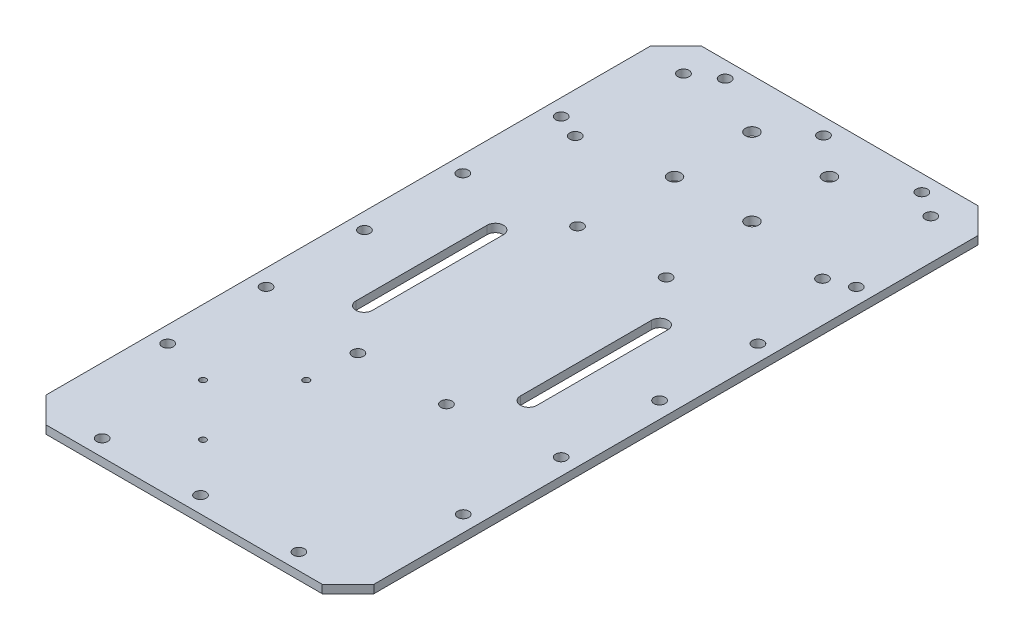
from build123d import *

# Parameters (mm, degrees)
SKETCH2_R           = 2.159
SKETCH2_R_2         = 2.54
SKETCH2_R_3         = 1.25
BOSS_EXTRUDE1_DEPTH = 3.175


with BuildPart() as part:
    # Sketch2 → Boss-Extrude1 (new body)
    with BuildSketch(Plane(origin=(0, 0, 0), x_dir=(1, 0, 0), z_dir=(0, 1, 0))):
        Polygon((0, 10), (0, 244), (10, 254), (117, 254), (127, 244), (127, 10), (117, 0), (10, 0), align=None)
        with Locations(Location((6.35, 88.9, 0), (0, 0, 270))):
            Circle(SKETCH2_R, mode=Mode.SUBTRACT)
        with Locations(Location((6.35, 165.1, 0), (0, 0, 270))):
            Circle(SKETCH2_R, mode=Mode.SUBTRACT)
        with Locations(Location((120.65, 165.1, 0), (0, 0, 270))):
            Circle(SKETCH2_R, mode=Mode.SUBTRACT)
        with Locations(Location((120.81, 50.8, 0), (0, 0, 270))):
            Circle(SKETCH2_R, mode=Mode.SUBTRACT)
        with Locations(Location((6.35, 50.8, 0), (0, 0, 270))):
            Circle(SKETCH2_R, mode=Mode.SUBTRACT)
        with Locations(Location((25.4, 247.65, 0), (0, 0, 270))):
            Circle(SKETCH2_R, mode=Mode.SUBTRACT)
        with Locations(Location((101.6, 247.65, 0), (0, 0, 270))):
            Circle(SKETCH2_R, mode=Mode.SUBTRACT)
        with Locations(Location((101.6, 6.35, 0), (0, 0, 270))):
            Circle(SKETCH2_R, mode=Mode.SUBTRACT)
        with Locations(Location((25.4, 6.35, 0), (0, 0, 270))):
            Circle(SKETCH2_R, mode=Mode.SUBTRACT)
        with Locations(Location((15.621, 241.3, 0), (0, 0, 270))):
            Circle(SKETCH2_R, mode=Mode.SUBTRACT)
        with Locations(Location((15.621, 199.39, 0), (0, 0, 270))):
            Circle(SKETCH2_R, mode=Mode.SUBTRACT)
        with Locations(Location((111.379, 199.39, 0), (0, 0, 270))):
            Circle(SKETCH2_R, mode=Mode.SUBTRACT)
        with Locations(Location((111.379, 241.3, 0), (0, 0, 270))):
            Circle(SKETCH2_R, mode=Mode.SUBTRACT)
        with Locations(Location((46.355, 169.545, 0), (0, 0, 270))):
            Circle(SKETCH2_R, mode=Mode.SUBTRACT)
        with Locations(Location((46.355, 84.455, 0), (0, 0, 270))):
            Circle(SKETCH2_R, mode=Mode.SUBTRACT)
        with Locations(Location((80.645, 84.455, 0), (0, 0, 270))):
            Circle(SKETCH2_R, mode=Mode.SUBTRACT)
        with Locations(Location((80.645, 169.545, 0), (0, 0, 270))):
            Circle(SKETCH2_R, mode=Mode.SUBTRACT)
        with Locations(Location((120.65, 88.9, 0), (0, 0, 270))):
            Circle(SKETCH2_R, mode=Mode.SUBTRACT)
        with Locations(Location((48.50003, 234.95, 0), (0, 0, 270))):
            Circle(SKETCH2_R_2, mode=Mode.SUBTRACT)
        with Locations(Location((78.49997, 234.95, 0), (0, 0, 270))):
            Circle(SKETCH2_R_2, mode=Mode.SUBTRACT)
        with Locations(Location((78.49997, 204.95006, 0), (0, 0, 270))):
            Circle(SKETCH2_R_2, mode=Mode.SUBTRACT)
        with Locations(Location((48.50003, 204.95006, 0), (0, 0, 270))):
            Circle(SKETCH2_R_2, mode=Mode.SUBTRACT)
        with Locations(Location((120.65, 203.2, 0), (0, 0, 270))):
            Circle(SKETCH2_R, mode=Mode.SUBTRACT)
        with Locations(Location((6.35, 203.2, 0), (0, 0, 270))):
            Circle(SKETCH2_R, mode=Mode.SUBTRACT)
        with Locations(Location((63.5, 247.65, 0), (0, 0, 270))):
            Circle(SKETCH2_R, mode=Mode.SUBTRACT)
        with Locations(Location((63.5, 6.35, 0), (0, 0, 270))):
            Circle(SKETCH2_R, mode=Mode.SUBTRACT)
        with Locations(Location((120.65, 127, 0), (0, 0, 270))):
            Circle(SKETCH2_R, mode=Mode.SUBTRACT)
        with Locations(Location((6.35, 127, 0), (0, 0, 270))):
            Circle(SKETCH2_R, mode=Mode.SUBTRACT)
        with Locations(Location((25.4, 45.4, 0), (0, 0, 270))):
            Circle(SKETCH2_R_3, mode=Mode.SUBTRACT)
        with Locations(Location((45.4, 65.4, 0), (0, 0, 270))):
            Circle(SKETCH2_R_3, mode=Mode.SUBTRACT)
        with Locations(Location((45.4, 25.4, 0), (0, 0, 270))):
            Circle(SKETCH2_R_3, mode=Mode.SUBTRACT)
        with BuildLine():
            Line((34.808835003, 152.4), (34.808835003, 101.6))
            ThreePointArc((34.808835003, 101.6), (31.633835003, 98.425), (28.458835003, 101.6))
            Line((28.458835003, 101.6), (28.458835003, 152.4))
            ThreePointArc((28.458835003, 152.4), (31.633835003, 155.575), (34.808835003, 152.4))
        make_face(mode=Mode.SUBTRACT)
        with BuildLine():
            Line((92.191164997, 152.4), (92.191164997, 101.6))
            ThreePointArc((92.191164997, 101.6), (95.366164997, 98.425), (98.541164997, 101.6))
            Line((98.541164997, 101.6), (98.541164997, 152.4))
            ThreePointArc((98.541164997, 152.4), (95.366164997, 155.575), (92.191164997, 152.4))
        make_face(mode=Mode.SUBTRACT)
    extrude(amount=BOSS_EXTRUDE1_DEPTH)


solid = part.part
